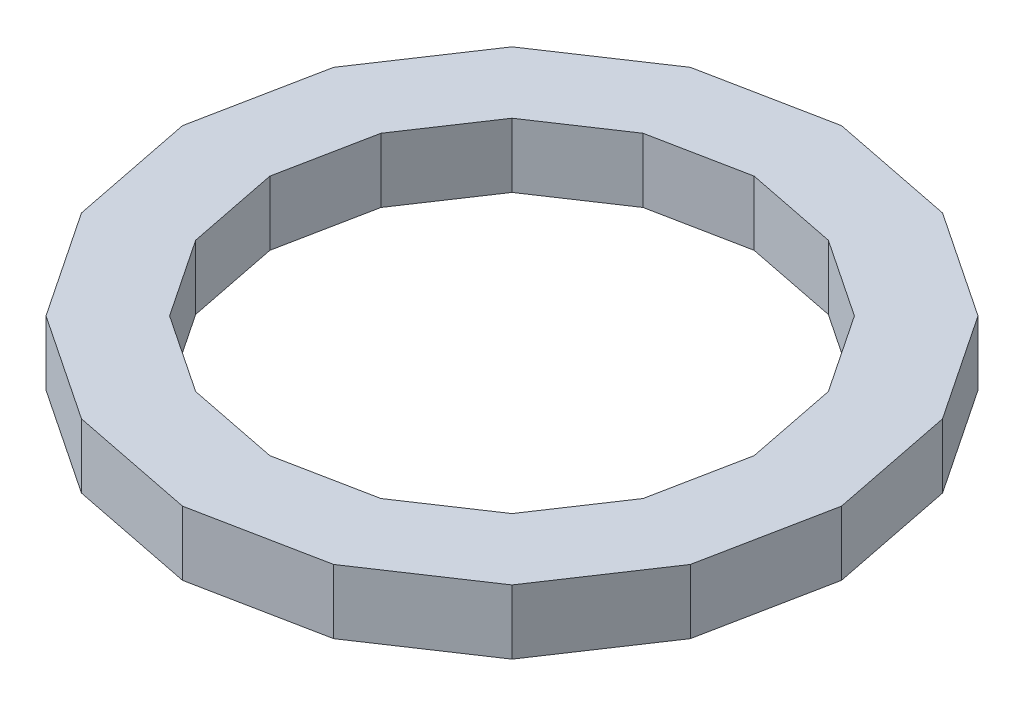
from build123d import *

# Parameters (mm, degrees)
BOSS_EXTRUDE1_DEPTH = 19.05


with BuildPart() as part:
    # Sketch1 → Boss-Extrude1 (new body)
    with BuildSketch(Plane(origin=(0, 0, 0), x_dir=(1, 0, 0), z_dir=(0, 1, 0))):
        Polygon((97.647078559, 0), (90.21413729, 37.367919183), (69.046911412, 69.046911412), (37.367919183, 90.21413729), (0, 97.647078559), (-37.367919183, 90.21413729), (-69.046911412, 69.046911412), (-90.21413729, 37.367919183), (-97.647078559, 0), (-90.21413729, -37.367919183), (-69.046911412, -69.046911412), (-37.367919183, -90.21413729), (0, -97.647078559), (37.367919183, -90.21413729), (69.046911412, -69.046911412), (90.21413729, -37.367919183), align=None)
        Polygon((71.74946314, 0), (66.287860464, 27.457330825), (50.734531933, 50.734531933), (27.457330825, 66.287860464), (0, 71.74946314), (-27.457330825, 66.287860464), (-50.734531933, 50.734531933), (-66.287860464, 27.457330825), (-71.74946314, 0), (-66.287860464, -27.457330825), (-50.734531933, -50.734531933), (-27.457330825, -66.287860464), (0, -71.74946314), (27.457330825, -66.287860464), (50.734531933, -50.734531933), (66.287860464, -27.457330825), align=None, mode=Mode.SUBTRACT)
    extrude(amount=BOSS_EXTRUDE1_DEPTH)


solid = part.part
